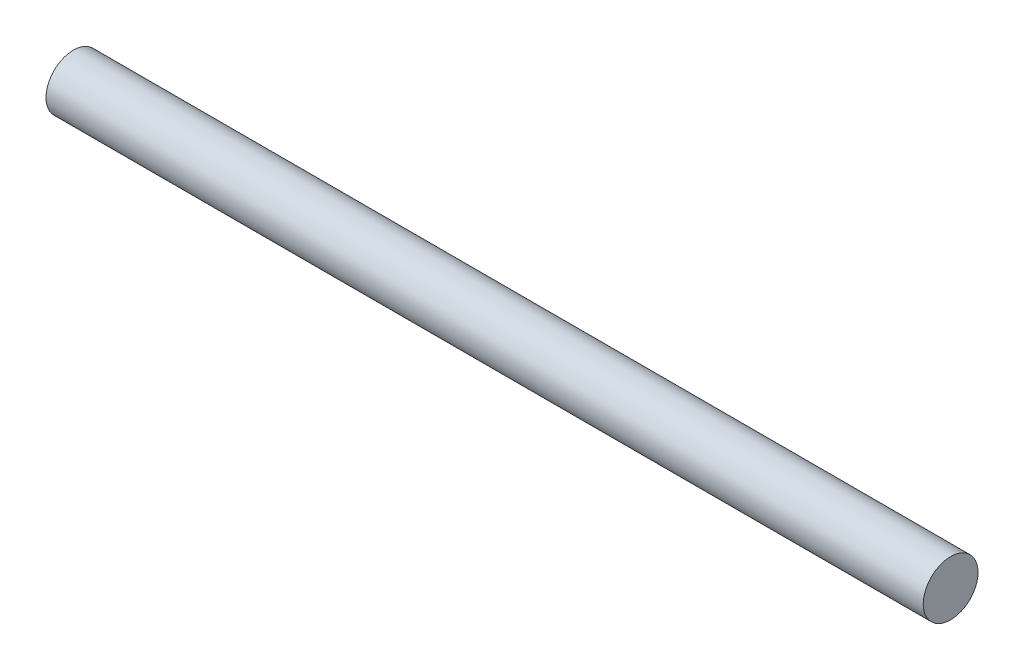
from build123d import *

# Parameters (mm, degrees)
SKETCH1_R           = 19.05
BOSS_EXTRUDE1_DEPTH = 304.8


with BuildPart() as part:
    # Sketch1 → Boss-Extrude1 (new, symmetric)
    with BuildSketch(Plane(origin=(0, 0, 0), x_dir=(0, 0, -1), z_dir=(1, 0, 0))):
        with Locations(Location((0, 0, 0), (0, 0, 180))):
            Circle(SKETCH1_R)
    extrude(amount=BOSS_EXTRUDE1_DEPTH, both=True)


solid = part.part
